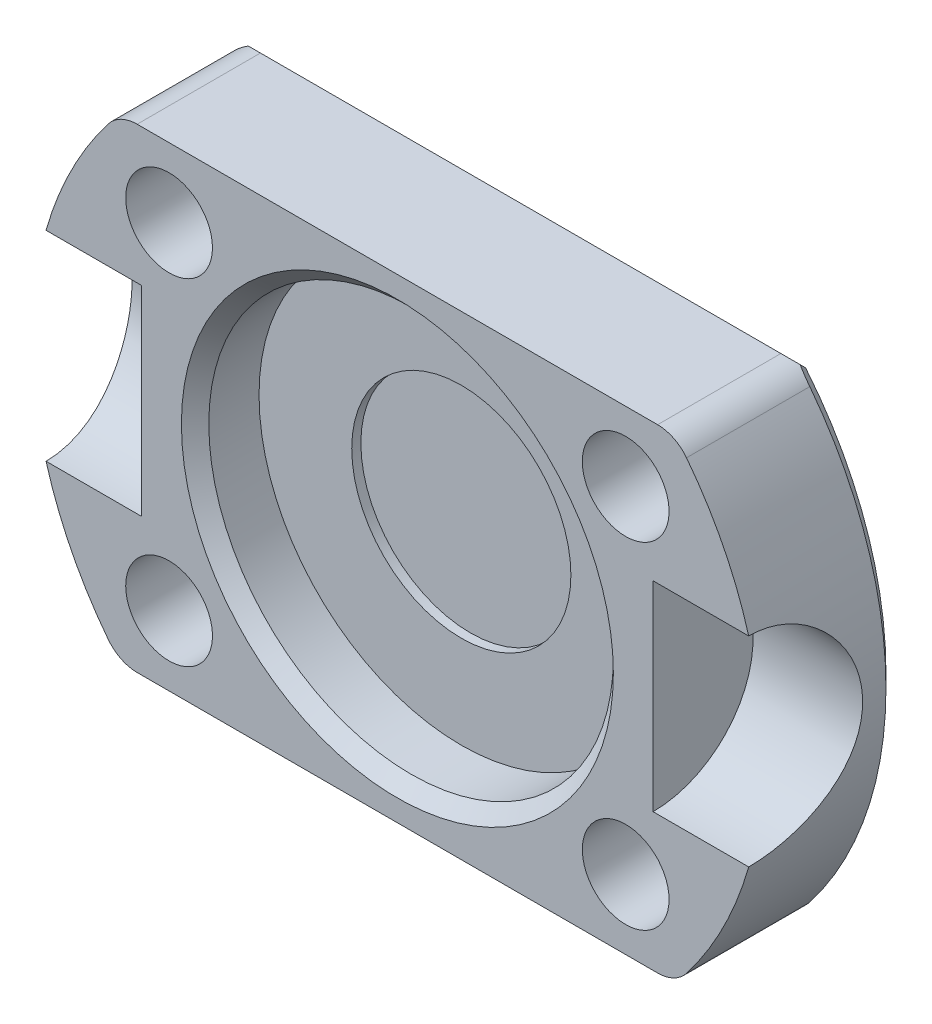
from build123d import *

# Parameters (mm, degrees)
AUFSATZ_LINEAR_AUSTRAGEN1_DEPTH = 7.5
SKIZZE2_R                       = 11.075
SCHNITT_LINEAR_AUSTRAGEN1_DEPTH = 3.5
SKIZZE3_R                       = 5.475
SCHNITT_LINEAR_AUSTRAGEN2_DEPTH = 38.165171868
SKIZZE4_R                       = 2.375
SCHNITT_LINEAR_AUSTRAGEN3_DEPTH = 6
FASE1_SIZE                      = 0.75
VERRUNDUNG1_R                   = 2
SKIZZE5_R                       = 6
SCHNITT_LINEAR_AUSTRAGEN4_DEPTH = 0.5


with BuildPart() as part:
    # Skizze1 → Aufsatz-Linear austragen1 (new body)
    with BuildSketch(Plane.XY):
        with BuildLine():
            Line((-15.198684154, 13), (15.198684154, 13))
            ThreePointArc((15.198684154, 13), (20, 0), (15.198684154, -13))
            Line((15.198684154, -13), (-15.198684154, -13))
            ThreePointArc((-15.198684154, -13), (-20, 0), (-15.198684154, 13))
        make_face()
    extrude(amount=AUFSATZ_LINEAR_AUSTRAGEN1_DEPTH)

    # Skizze2 → Schnitt-Linear austragen1 (cut)
    with BuildSketch(Plane.XY.offset(7.5)):
        Circle(SKIZZE2_R)
    extrude(amount=-SCHNITT_LINEAR_AUSTRAGEN1_DEPTH, mode=Mode.SUBTRACT)

    # Skizze3 → Schnitt-Linear austragen2 (cut, through all)
    with BuildSketch(Plane(origin=(14, 0, 0), x_dir=(0, 0, -1), z_dir=(1, 0, 0))):
        with Locations((-7.5, 0)):
            Circle(SKIZZE3_R)
    schnitt_linear_austragen2 = extrude(amount=SCHNITT_LINEAR_AUSTRAGEN2_DEPTH, mode=Mode.SUBTRACT)

    # Spiegeln1: Schnitt-Linear austragen2 across plane
    add(schnitt_linear_austragen2.mirror(Plane(origin=(0, 0, 0), x_dir=(0, 0, 1), z_dir=(1, 0, 0))), mode=Mode.SUBTRACT)

    # Skizze4 → Schnitt-Linear austragen3 (cut)
    with BuildSketch(Plane.XY.offset(7.5)):
        with Locations((-12.5, 9.2)):
            Circle(SKIZZE4_R)
        with Locations(Location((12.5, 9.2, 0), (0, 0, 180))):
            Circle(SKIZZE4_R)
        with Locations((12.5, -9.2)):
            Circle(SKIZZE4_R)
        with Locations(Location((-12.5, -9.2, 0), (0, 0, 180))):
            Circle(SKIZZE4_R)
    extrude(amount=-SCHNITT_LINEAR_AUSTRAGEN3_DEPTH, mode=Mode.SUBTRACT)

    # Fase1
    fase1_edges = [part.edges().sort_by_distance(p)[0] for p in [
        (-11.075, 0, 7.5),
        (0, 13, 0),
        (20, 0, 0),
        (0, -13, 0),
        (-20, 0, 0),
    ]]
    chamfer(fase1_edges, length=FASE1_SIZE)

    # Verrundung1
    verrundung1_edges = [part.edges().sort_by_distance(p)[0] for p in [
        (-15.198684154, -13, 4.125),
        (15.198684154, -13, 4.125),
        (15.198684154, 13, 4.125),
        (-15.198684154, 13, 4.125),
    ]]
    fillet(verrundung1_edges, radius=VERRUNDUNG1_R)

    # Skizze5 → Schnitt-Linear austragen4 (cut)
    with BuildSketch(Plane.XY.offset(4)):
        Circle(SKIZZE5_R)
    extrude(amount=-SCHNITT_LINEAR_AUSTRAGEN4_DEPTH, mode=Mode.SUBTRACT)


solid = part.part
